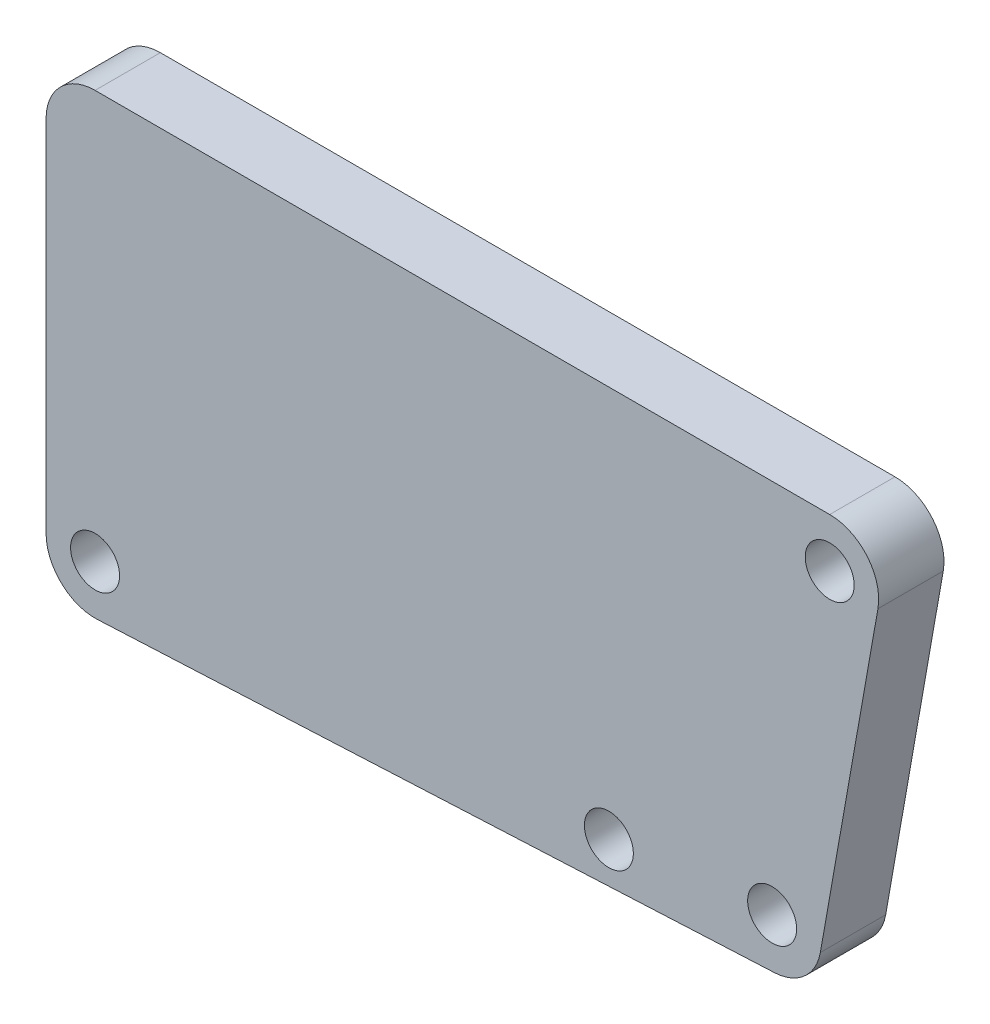
from build123d import *

# Parameters (mm, degrees)
SKETCH1_R           = 1.5
BOSS_EXTRUDE1_DEPTH = 4


with BuildPart() as part:
    # Sketch1 → Boss-Extrude1 (new body)
    with BuildSketch(Plane.XY):
        with BuildLine():
            Line((0, 3), (45, 3))
            ThreePointArc((45, 3), (47.298133329, 1.928362829), (47.954423259, -0.520944533))
            Line((47.954423259, -0.520944533), (44.427883645, -20.520944533))
            ThreePointArc((44.427883645, -20.520944533), (43.456627447, -22.25101053), (41.617963293, -22.996517797))
            Line((41.617963293, -22.996517797), (0.144502907, -24.996517797))
            ThreePointArc((0.144502907, -24.996517797), (-2.069600357, -24.171809006), (-3, -22))
            Line((-3, -22), (-3, 0))
            ThreePointArc((-3, 0), (-2.121320344, 2.121320344), (0, 3))
        make_face()
        with Locations((45, 0)):
            Circle(SKETCH1_R, mode=Mode.SUBTRACT)
        with Locations((41.473460386, -20)):
            Circle(SKETCH1_R, mode=Mode.SUBTRACT)
        with Locations((31.473460386, -21)):
            Circle(SKETCH1_R, mode=Mode.SUBTRACT)
        with Locations((0, -22)):
            Circle(SKETCH1_R, mode=Mode.SUBTRACT)
    extrude(amount=BOSS_EXTRUDE1_DEPTH)


solid = part.part
